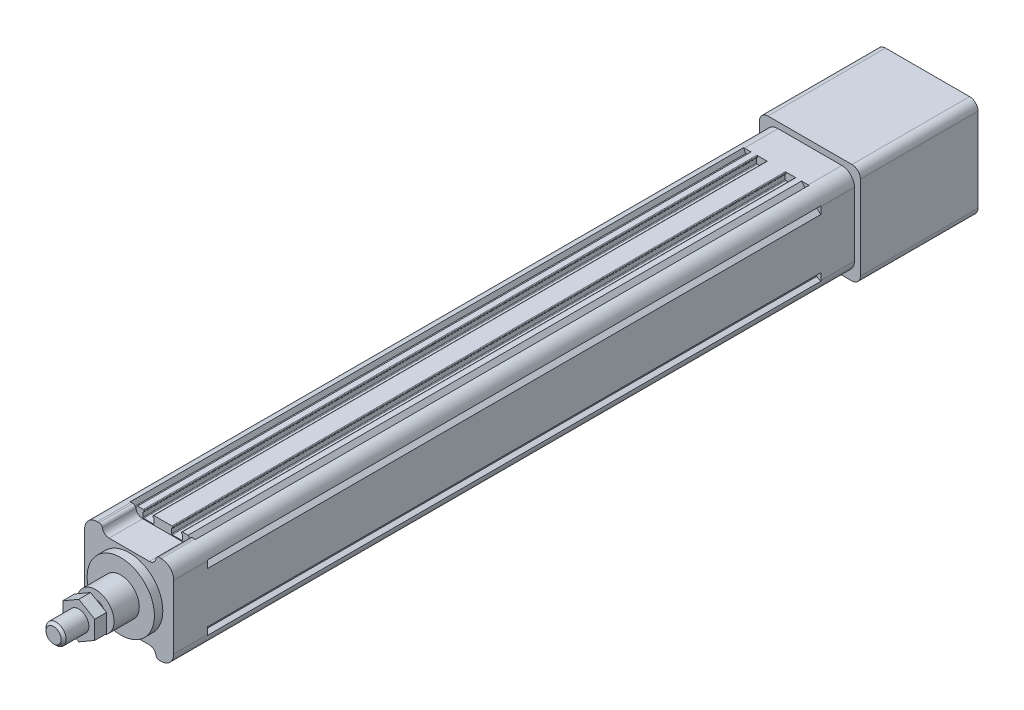
from build123d import *

# Parameters (mm, degrees)
SKETCH_1_R             = 2.1
EXTRUDE_1_DEPTH        = 365
EXTRUDE_2_DEPTH        = 20
SKETCH_7_R             = 20
EXTRUDE_3_DEPTH        = 5
SKETCH_9_R             = 11
EXTRUDE_4_DEPTH        = 15
SKETCH_10_R            = 6
EXTRUDE_5_DEPTH        = 25
EXTRUDE_START          = 20
EXTRUDE_6_DEPTH        = 20
EXTRUDE_7_DEPTH        = 70
SKETCH_14_R            = 19
CUT_EXTRUDE_2_DEPTH    = 70
HOLE_WIZARD_M6_1_D     = 5
HOLE_WIZARD_M6_1_DEPTH = 15
HOLE_WIZARD_M6_1_TIP   = 1.502151548
CHAMFER_1_SIZE         = 1.5
EXTRUDE_START_2        = 3
EXTRUDE_8_DEPTH        = 7


with BuildPart() as part:
    # 草图1 → 凸台-拉伸1 (new body)
    with BuildSketch(Plane.XY):
        with BuildLine():
            Line((-18.2, 24), (-19.443439638, 26.486879276))
            ThreePointArc((-19.443439638, 26.486879276), (-24.303300859, 24.303300859), (-26.486879276, 19.443439638))
            Line((-26.486879276, 19.443439638), (-24, 18.2))
            Line((-24, 18.2), (-24, 17.1))
            Line((-24, 17.1), (-26.5, 15))
            Line((-26.5, 15), (-26.5, -15))
            Line((-26.5, -15), (-24, -17.1))
            Line((-24, -17.1), (-24, -18.2))
            Line((-24, -18.2), (-26.486879276, -19.443439638))
            ThreePointArc((-26.486879276, -19.443439638), (-24.303300859, -24.303300859), (-19.443439638, -26.486879276))
            Line((-19.443439638, -26.486879276), (-18.2, -24))
            Line((-18.2, -24), (-17.1, -24))
            Line((-17.1, -24), (-15, -26.5))
            Line((-15, -26.5), (-11.65, -26.5))
            ThreePointArc((-11.65, -26.5), (-11.367157288, -26.382842712), (-11.25, -26.1))
            Line((-11.25, -26.1), (-11.25, -25.6))
            ThreePointArc((-11.25, -25.6), (-11.367157288, -25.317157288), (-11.65, -25.2))
            Line((-11.65, -25.2), (-11.75, -25.2))
            Line((-11.75, -25.2), (-11.75, -22.4))
            ThreePointArc((-11.75, -22.4), (-11.632842712, -22.117157288), (-11.35, -22))
            Line((-11.35, -22), (-5.65, -22))
            ThreePointArc((-5.65, -22), (-5.367157288, -22.117157288), (-5.25, -22.4))
            Line((-5.25, -22.4), (-5.25, -25.2))
            Line((-5.25, -25.2), (-5.35, -25.2))
            ThreePointArc((-5.35, -25.2), (-5.632842712, -25.317157288), (-5.75, -25.6))
            Line((-5.75, -25.6), (-5.75, -26.1))
            ThreePointArc((-5.75, -26.1), (-5.632842712, -26.382842712), (-5.35, -26.5))
            Line((-5.35, -26.5), (5.35, -26.5))
            ThreePointArc((5.35, -26.5), (5.632842712, -26.382842712), (5.75, -26.1))
            Line((5.75, -26.1), (5.75, -25.6))
            ThreePointArc((5.75, -25.6), (5.632842712, -25.317157288), (5.35, -25.2))
            Line((5.35, -25.2), (5.25, -25.2))
            Line((5.25, -25.2), (5.25, -22.4))
            ThreePointArc((5.25, -22.4), (5.367157288, -22.117157288), (5.65, -22))
            Line((5.65, -22), (11.35, -22))
            ThreePointArc((11.35, -22), (11.632842712, -22.117157288), (11.75, -22.4))
            Line((11.75, -22.4), (11.75, -25.2))
            Line((11.75, -25.2), (11.65, -25.2))
            ThreePointArc((11.65, -25.2), (11.367157288, -25.317157288), (11.25, -25.6))
            Line((11.25, -25.6), (11.25, -26.1))
            ThreePointArc((11.25, -26.1), (11.367157288, -26.382842712), (11.65, -26.5))
            Line((11.65, -26.5), (15, -26.5))
            Line((15, -26.5), (17.1, -24))
            Line((17.1, -24), (18.2, -24))
            Line((18.2, -24), (19.443439638, -26.486879276))
            ThreePointArc((19.443439638, -26.486879276), (24.303300859, -24.303300859), (26.486879276, -19.443439638))
            Line((26.486879276, -19.443439638), (24, -18.2))
            Line((24, -18.2), (24, -17.1))
            Line((24, -17.1), (26.5, -15))
            Line((26.5, -15), (26.5, 15))
            Line((26.5, 15), (24, 17.1))
            Line((24, 17.1), (24, 18.2))
            Line((24, 18.2), (26.486879276, 19.443439638))
            ThreePointArc((26.486879276, 19.443439638), (24.303300859, 24.303300859), (19.443439638, 26.486879276))
            Line((19.443439638, 26.486879276), (18.2, 24))
            Line((18.2, 24), (17.1, 24))
            Line((17.1, 24), (15, 26.5))
            Line((15, 26.5), (11.65, 26.5))
            ThreePointArc((11.65, 26.5), (11.367157288, 26.382842712), (11.25, 26.1))
            Line((11.25, 26.1), (11.25, 25.6))
            ThreePointArc((11.25, 25.6), (11.367157288, 25.317157288), (11.65, 25.2))
            Line((11.65, 25.2), (11.75, 25.2))
            Line((11.75, 25.2), (11.75, 22.4))
            ThreePointArc((11.75, 22.4), (11.632842712, 22.117157288), (11.35, 22))
            Line((11.35, 22), (5.65, 22))
            ThreePointArc((5.65, 22), (5.367157288, 22.117157288), (5.25, 22.4))
            Line((5.25, 22.4), (5.25, 25.2))
            Line((5.25, 25.2), (5.35, 25.2))
            ThreePointArc((5.35, 25.2), (5.632842712, 25.317157288), (5.75, 25.6))
            Line((5.75, 25.6), (5.75, 26.1))
            ThreePointArc((5.75, 26.1), (5.632842712, 26.382842712), (5.35, 26.5))
            Line((5.35, 26.5), (-5.35, 26.5))
            ThreePointArc((-5.35, 26.5), (-5.632842712, 26.382842712), (-5.75, 26.1))
            Line((-5.75, 26.1), (-5.75, 25.6))
            ThreePointArc((-5.75, 25.6), (-5.632842712, 25.317157288), (-5.35, 25.2))
            Line((-5.35, 25.2), (-5.25, 25.2))
            Line((-5.25, 25.2), (-5.25, 22.4))
            ThreePointArc((-5.25, 22.4), (-5.367157288, 22.117157288), (-5.65, 22))
            Line((-5.65, 22), (-11.35, 22))
            ThreePointArc((-11.35, 22), (-11.632842712, 22.117157288), (-11.75, 22.4))
            Line((-11.75, 22.4), (-11.75, 25.2))
            Line((-11.75, 25.2), (-11.65, 25.2))
            ThreePointArc((-11.65, 25.2), (-11.367157288, 25.317157288), (-11.25, 25.6))
            Line((-11.25, 25.6), (-11.25, 26.1))
            ThreePointArc((-11.25, 26.1), (-11.367157288, 26.382842712), (-11.65, 26.5))
            Line((-11.65, 26.5), (-15, 26.5))
            Line((-15, 26.5), (-17.1, 24))
            Line((-17.1, 24), (-18.2, 24))
        make_face()
        with Locations(Location((19, 19, 0), (0, 0, 180))):
            Circle(SKETCH_1_R, mode=Mode.SUBTRACT)
        with Locations(Location((19, -19, 0), (0, 0, 180))):
            Circle(SKETCH_1_R, mode=Mode.SUBTRACT)
        with Locations(Location((-19, -19, 0), (0, 0, 180))):
            Circle(SKETCH_1_R, mode=Mode.SUBTRACT)
        with Locations(Location((-19, 19, 0), (0, 0, 180))):
            Circle(SKETCH_1_R, mode=Mode.SUBTRACT)
        with BuildLine():
            Line((19.773719933, 3), (23.3, 3))
            Line((23.3, 3), (23.3, -3))
            Line((23.3, -3), (19.773719933, -3))
            ThreePointArc((19.773719933, -3), (0, -20), (-19.773719933, -3))
            Line((-19.773719933, -3), (-23.3, -3))
            Line((-23.3, -3), (-23.3, 3))
            Line((-23.3, 3), (-19.773719933, 3))
            ThreePointArc((-19.773719933, 3), (0, 20), (19.773719933, 3))
        make_face(mode=Mode.SUBTRACT)
    extrude(amount=EXTRUDE_1_DEPTH)

    # 草图6 → 凸台-拉伸2 (add)
    with BuildSketch(Plane.XY.offset(365)):
        with BuildLine():
            Line((-26.5, -19), (-26.5, 19))
            ThreePointArc((-26.5, 19), (-24.303300859, 24.303300859), (-19, 26.5))
            Line((-19, 26.5), (-17.916079783, 26.5))
            ThreePointArc((-17.916079783, 26.5), (-16.625085334, 26.027525232), (-15.944053189, 24.833333333))
            ThreePointArc((-15.944053189, 24.833333333), (-14.581988897, 22.444949537), (-12, 21.5))
            Line((-12, 21.5), (12, 21.5))
            ThreePointArc((12, 21.5), (14.581988897, 22.444949537), (15.944053189, 24.833333333))
            ThreePointArc((15.944053189, 24.833333333), (16.625085334, 26.027525232), (17.916079783, 26.5))
            Line((17.916079783, 26.5), (19, 26.5))
            ThreePointArc((19, 26.5), (24.303300859, 24.303300859), (26.5, 19))
            Line((26.5, 19), (26.5, -19))
            ThreePointArc((26.5, -19), (24.303300859, -24.303300859), (19, -26.5))
            Line((19, -26.5), (17.916079783, -26.5))
            ThreePointArc((17.916079783, -26.5), (16.625085334, -26.027525232), (15.944053189, -24.833333333))
            ThreePointArc((15.944053189, -24.833333333), (14.581988897, -22.444949537), (12, -21.5))
            Line((12, -21.5), (-12, -21.5))
            ThreePointArc((-12, -21.5), (-14.581988897, -22.444949537), (-15.944053189, -24.833333333))
            ThreePointArc((-15.944053189, -24.833333333), (-16.625085334, -26.027525232), (-17.916079783, -26.5))
            Line((-17.916079783, -26.5), (-19, -26.5))
            ThreePointArc((-19, -26.5), (-24.303300859, -24.303300859), (-26.5, -19))
        make_face()
    extrude(amount=EXTRUDE_2_DEPTH)

    # 草图7 → 凸台-拉伸3 (add)
    with BuildSketch(Plane.XY.offset(385)):
        Circle(SKETCH_7_R)
    extrude(amount=EXTRUDE_3_DEPTH)

    # 草图9 → 凸台-拉伸4 (add)
    with BuildSketch(Plane.XY.offset(390)):
        Circle(SKETCH_9_R)
    extrude(amount=EXTRUDE_4_DEPTH)

    # 草图10 → 凸台-拉伸5 (add)
    with BuildSketch(Plane.XY.offset(405)):
        Circle(SKETCH_10_R)
    extrude(amount=EXTRUDE_5_DEPTH)

    # 草图11 → 凸台-拉伸6 (add)
    with BuildSketch(Plane(origin=(0, 0, 0), x_dir=(-1, 0, 0), z_dir=(0, 0, -1)).offset(EXTRUDE_START)):
        with BuildLine():
            Line((-19, -26.5), (19, -26.5))
            ThreePointArc((19, -26.5), (24.303300859, -24.303300859), (26.5, -19))
            Line((26.5, -19), (26.5, 19))
            ThreePointArc((26.5, 19), (24.303300859, 24.303300859), (19, 26.5))
            Line((19, 26.5), (-19, 26.5))
            ThreePointArc((-19, 26.5), (-24.303300859, 24.303300859), (-26.5, 19))
            Line((-26.5, 19), (-26.5, -19))
            ThreePointArc((-26.5, -19), (-24.303300859, -24.303300859), (-19, -26.5))
        make_face()
    extrude(amount=-EXTRUDE_6_DEPTH)

    # 草图12 → 凸台-拉伸7 (add)
    with BuildSketch(Plane(origin=(0, 0, -20), x_dir=(-1, 0, 0), z_dir=(0, 0, -1))):
        with BuildLine():
            Line((-25, -30), (25, -30))
            ThreePointArc((25, -30), (28.535533906, -28.535533906), (30, -25))
            Line((30, -25), (30, 25))
            ThreePointArc((30, 25), (28.535533906, 28.535533906), (25, 30))
            Line((25, 30), (-25, 30))
            ThreePointArc((-25, 30), (-28.535533906, 28.535533906), (-30, 25))
            Line((-30, 25), (-30, -25))
            ThreePointArc((-30, -25), (-28.535533906, -28.535533906), (-25, -30))
        make_face()
    extrude(amount=EXTRUDE_7_DEPTH)

    # 草图14 → 切除-拉伸2 (cut)
    with BuildSketch(Plane(origin=(0, 0, -90), x_dir=(-1, 0, 0), z_dir=(0, 0, -1))):
        Circle(SKETCH_14_R)
    extrude(amount=-CUT_EXTRUDE_2_DEPTH, mode=Mode.SUBTRACT)

    # M6 螺纹孔1
    with Locations(Plane.ZY.offset(26.5)):
        with Locations((375, 11), (375, -11), (-10, 11), (-10, -11)):
            Hole(HOLE_WIZARD_M6_1_D / 2, depth=HOLE_WIZARD_M6_1_DEPTH)
            with Locations((0, 0, -(HOLE_WIZARD_M6_1_DEPTH + HOLE_WIZARD_M6_1_TIP / 2))):  # 118° drill point
                Cone(0, HOLE_WIZARD_M6_1_D / 2, HOLE_WIZARD_M6_1_TIP, mode=Mode.SUBTRACT)

    # 倒角1
    chamfer_1_edges = [part.edges().sort_by_distance(p)[0] for p in [
        (-6, 0, 430),
    ]]
    chamfer(chamfer_1_edges, length=CHAMFER_1_SIZE)

    # 草图17 → 凸台-拉伸8 (add)
    with BuildSketch(Plane.XY.offset(405).offset(EXTRUDE_START_2)):
        Polygon((0, 10.969655115), (-9.5, 5.484827557), (-9.5, -5.484827557), (0, -10.969655115), (9.5, -5.484827557), (9.5, 5.484827557), align=None)
    extrude(amount=EXTRUDE_8_DEPTH)


solid = part.part
